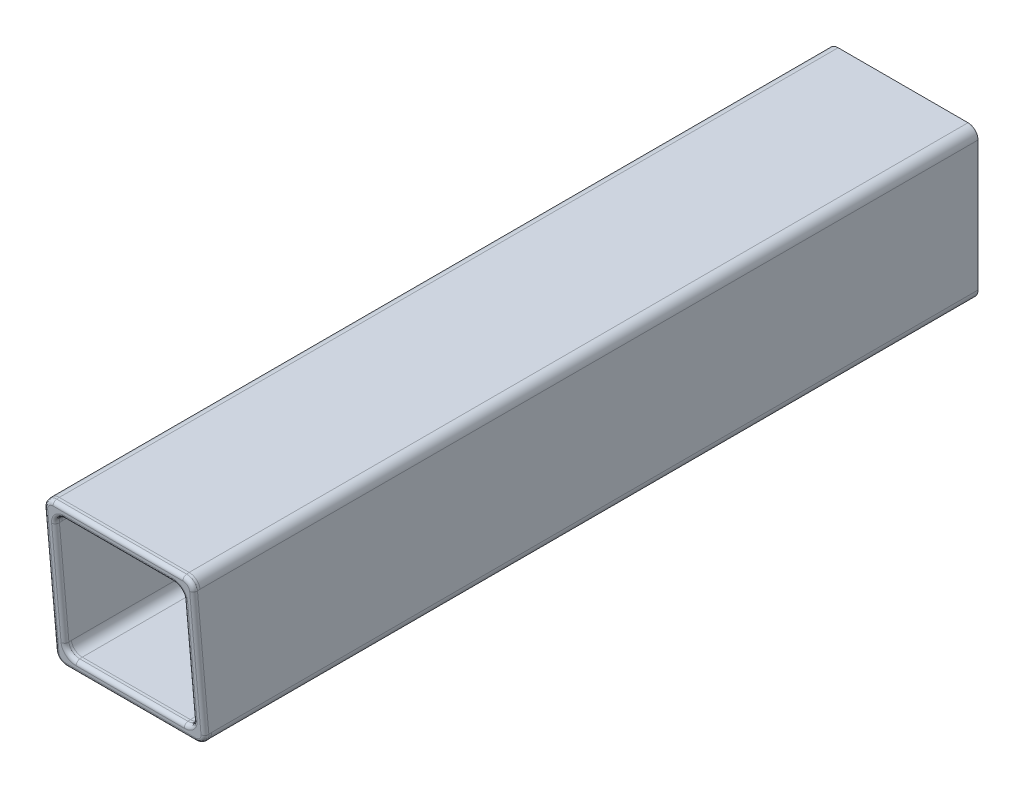
from build123d import *

# Parameters (mm, degrees)
BOSS_EXTRUDE1_DEPTH = 198
CUT_EXTRUDE3_DEPTH  = 206.200438596
BOSS_EXTRUDE2_DEPTH = 1.636319424
FILLET1_R           = 1


with BuildPart() as part:
    # Sketch1 → Boss-Extrude1 (new body)
    with BuildSketch(Plane.XY):
        with BuildLine():
            Line((2.54, 0), (35.56, 0))
            ThreePointArc((35.56, 0), (37.356051224, -0.743948776), (38.1, -2.54))
            Line((38.1, -2.54), (38.1, -35.56))
            ThreePointArc((38.1, -35.56), (37.356051224, -37.356051224), (35.56, -38.1))
            Line((35.56, -38.1), (2.54, -38.1))
            ThreePointArc((2.54, -38.1), (0.743948776, -37.356051224), (0, -35.56))
            Line((0, -35.56), (0, -2.54))
            ThreePointArc((0, -2.54), (0.743948776, -0.743948776), (2.54, 0))
        make_face()
        with BuildLine():
            Line((5.3086, -2.7686), (32.7914, -2.7686))
            ThreePointArc((32.7914, -2.7686), (34.587451224, -3.512548776), (35.3314, -5.3086))
            Line((35.3314, -5.3086), (35.3314, -32.7914))
            ThreePointArc((35.3314, -32.7914), (34.587451224, -34.587451224), (32.7914, -35.3314))
            Line((32.7914, -35.3314), (5.3086, -35.3314))
            ThreePointArc((5.3086, -35.3314), (3.512548776, -34.587451224), (2.7686, -32.7914))
            Line((2.7686, -32.7914), (2.7686, -5.3086))
            ThreePointArc((2.7686, -5.3086), (3.512548776, -3.512548776), (5.3086, -2.7686))
        make_face(mode=Mode.SUBTRACT)
    extrude(amount=BOSS_EXTRUDE1_DEPTH)

    # Sketch3 → Cut-Extrude3 (cut, through all)
    with BuildSketch(Plane(origin=(38.1, 0, 0), x_dir=(0, 0, -1), z_dir=(1, 0, 0))):
        Polygon((-198, 0), (-194.66668192, -38.1), (-198, -38.1), align=None)
    extrude(amount=-CUT_EXTRUDE3_DEPTH, mode=Mode.SUBTRACT)

    # Sketch4 → Boss-Extrude2 (add)
    with BuildSketch(Plane(origin=(0, -17.191169589, 196.495967548), x_dir=(1, 0, 0), z_dir=(0, -0.08715574274765185, 0.9961946980917462))):
        with BuildLine():
            Line((2.54, -20.988698746), (35.56, -20.988698746))
            add(Edge.make_bspline(
                [(35.56, -20.988698746), (38.1, -20.988698746), (38.1, -18.438996359)],
                knots=[0, 0, 0, 1.570796327, 1.570796327, 1.570796327], degree=2, weights=[1, 0.707106781, 1]))
            Line((38.1, -18.438996359), (38.1, 14.707134677))
            add(Edge.make_bspline(
                [(38.1, 14.707134677), (38.1, 17.256837064), (35.56, 17.256837064)],
                knots=[4.71238898, 4.71238898, 4.71238898, 6.283185307, 6.283185307, 6.283185307], degree=2, weights=[1, 0.707106781, 1]))
            Line((35.56, 17.256837064), (2.54, 17.256837064))
            add(Edge.make_bspline(
                [(2.54, 17.256837064), (0, 17.256837064), (0, 14.707134677)],
                knots=[3.141592654, 3.141592654, 3.141592654, 4.71238898, 4.71238898, 4.71238898], degree=2, weights=[1, 0.707106781, 1]))
            Line((0, 14.707134677), (0, -18.438996359))
            add(Edge.make_bspline(
                [(0, -18.438996359), (0, -20.988698746), (2.54, -20.988698746)],
                knots=[4.71238898, 4.71238898, 4.71238898, 6.283185307, 6.283185307, 6.283185307], degree=2, weights=[1, 0.707106781, 1]))
        make_face()
        with BuildLine():
            Line((35.3314, 11.927959074), (35.3314, -15.659820757))
            add(Edge.make_bspline(
                [(32.7914, -18.209523144), (35.3314, -18.209523144), (35.3314, -15.659820757)],
                knots=[0, 0, 0, 1.570796327, 1.570796327, 1.570796327], degree=2, weights=[1, 0.707106781, 1]))
            Line((32.7914, -18.209523144), (5.3086, -18.209523144))
            add(Edge.make_bspline(
                [(2.7686, -15.659820757), (2.7686, -18.209523144), (5.3086, -18.209523144)],
                knots=[4.71238898, 4.71238898, 4.71238898, 6.283185307, 6.283185307, 6.283185307], degree=2, weights=[1, 0.707106781, 1]))
            Line((2.7686, -15.659820757), (2.7686, 11.927959074))
            add(Edge.make_bspline(
                [(5.3086, 14.477661462), (2.7686, 14.477661462), (2.7686, 11.927959074)],
                knots=[3.141592654, 3.141592654, 3.141592654, 4.71238898, 4.71238898, 4.71238898], degree=2, weights=[1, 0.707106781, 1]))
            Line((5.3086, 14.477661462), (32.7914, 14.477661462))
            add(Edge.make_bspline(
                [(35.3314, 11.927959074), (35.3314, 14.477661462), (32.7914, 14.477661462)],
                knots=[1.570796327, 1.570796327, 1.570796327, 3.141592654, 3.141592654, 3.141592654], degree=2, weights=[1, 0.707106781, 1]))
        make_face(mode=Mode.SUBTRACT)
    extrude(amount=BOSS_EXTRUDE2_DEPTH)

    # Fillet1
    fillet1_edges = [part.edges().sort_by_distance(p)[0] for p in [
        (35.3314, -19.192614635, 197.963433694),
        (34.589162497, -34.728352955, 196.604232712),
        (19.05, -35.474014635, 196.538995768),
        (3.510837922, -34.728353374, 196.604232675),
        (2.7686, -19.192614635, 197.963433694),
        (3.510837503, -3.656876315, 199.322634677),
        (19.05, -2.911214635, 199.387871621),
        (34.589162078, -3.656875896, 199.322634714),
        (0, -19.192614635, 197.963433694),
        (0.742237922, -37.496953374, 196.362011561),
        (19.05, -38.242614635, 196.296774654),
        (37.357762497, -37.496952955, 196.362011598),
        (38.1, -19.192614635, 197.963433694),
        (37.357762078, -0.888275896, 199.564855827),
        (19.05, -0.142614635, 199.630092735),
        (0.742237503, -0.888276315, 199.564855791),
    ]]
    fillet(fillet1_edges, radius=FILLET1_R)


solid = part.part
